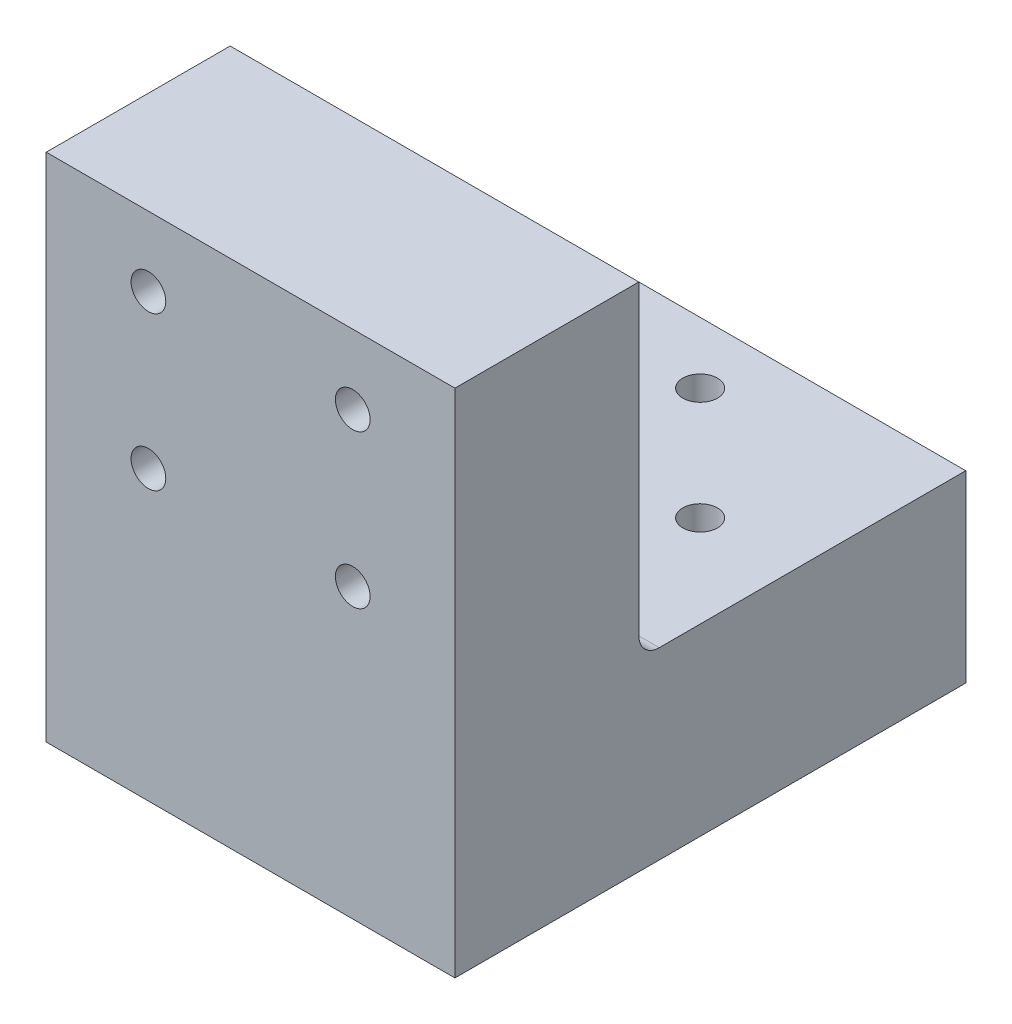
from build123d import *

# Parameters (mm, degrees)
BOSS_EXTRUDE2_DEPTH = 40
SKETCH6_R           = 3.25
SKETCH6_R_2         = 1.7
CUT_EXTRUDE1_DEPTH  = 72.582120673
SKETCH7_R           = 1.7
CUT_EXTRUDE2_DEPTH  = 58.818545186


with BuildPart() as part:
    # Sketch3 → Boss-Extrude2 (new body)
    with BuildSketch(Plane(origin=(0, 0, 0), x_dir=(0, 0, -1), z_dir=(1, 0, 0))):
        with BuildLine():
            Line((0, -23.186119874), (50, -23.186119874))
            Line((50, -23.186119874), (50, -5.186119874))
            Line((50, -5.186119874), (20, -5.186119874))
            ThreePointArc((20, -5.186119874), (18.585786438, -4.600333436), (18, -3.186119874))
            Line((18, -3.186119874), (18, 26.813880126))
            Line((18, 26.813880126), (0, 26.813880126))
            Line((0, 26.813880126), (0, -23.186119874))
        make_face()
    extrude(amount=BOSS_EXTRUDE2_DEPTH)

    # Sketch6 → Cut-Extrude1 (cut, through all)
    with BuildSketch(Plane(origin=(0, -5.186119874, 0), x_dir=(1, 0, 0), z_dir=(0, 1, 0))):
        with Locations(Location((20, 33, 0), (0, 0, 270))):
            Circle(SKETCH6_R)
        with Locations(Location((9, 33, 0), (0, 0, 270))):
            Circle(SKETCH6_R_2)
        with Locations(Location((20, 44, 0), (0, 0, 270))):
            Circle(SKETCH6_R_2)
        with Locations(Location((31, 33, 0), (0, 0, 270))):
            Circle(SKETCH6_R_2)
        with Locations(Location((20, 22, 0), (0, 0, 270))):
            Circle(SKETCH6_R_2)
    extrude(amount=-CUT_EXTRUDE1_DEPTH, mode=Mode.SUBTRACT)

    # Sketch7 → Cut-Extrude2 (cut, through all)
    with BuildSketch(Plane(origin=(0, 0, -18), x_dir=(-1, 0, 0), z_dir=(0, 0, -1))):
        with Locations(Location((-30, 20, 0), (0, 0, 90))):
            Circle(SKETCH7_R)
        with Locations(Location((-10, 20, 0), (0, 0, 90))):
            Circle(SKETCH7_R)
        with Locations(Location((-30, 5, 0), (0, 0, 90))):
            Circle(SKETCH7_R)
        with Locations(Location((-10, 5, 0), (0, 0, 90))):
            Circle(SKETCH7_R)
    extrude(amount=-CUT_EXTRUDE2_DEPTH, mode=Mode.SUBTRACT)


solid = part.part
